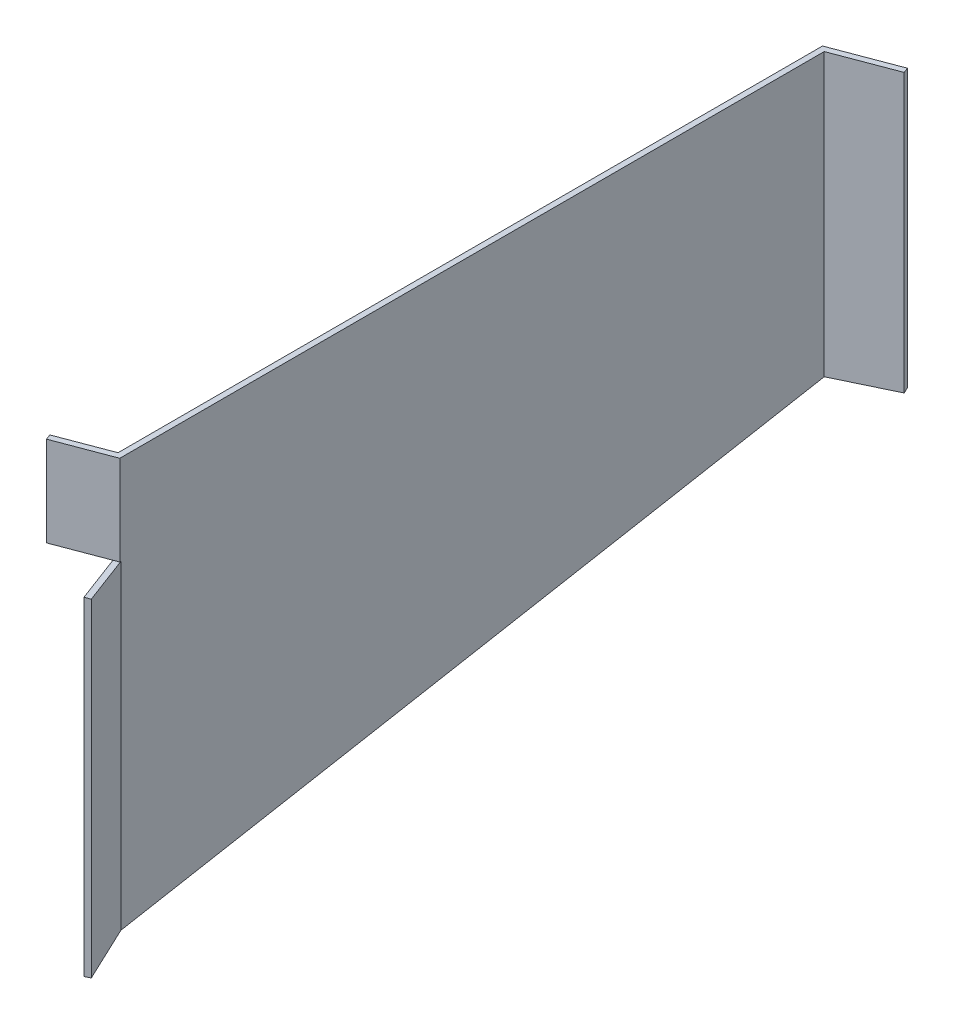
from build123d import *

# Parameters (mm, degrees)
SKETCH1_W           = 3.175
SKETCH1_H           = 395.409928
BOSS_EXTRUDE1_DEPTH = 228.6
CUT_EXTRUDE1_DEPTH  = 457.746156838
BOSS_EXTRUDE4_REACH = 458.746
BOSS_EXTRUDE5_DEPTH = 50.165
BOSS_EXTRUDE8_REACH = 449.107


with BuildPart() as part:
    # Sketch1 → Boss-Extrude1 (new body)
    with BuildSketch(Plane(origin=(0, 0, 0), x_dir=(1, 0, 0), z_dir=(0, 1, 0))):
        with Locations((1.5875, 197.704964)):
            Rectangle(SKETCH1_W, SKETCH1_H)
    extrude(amount=BOSS_EXTRUDE1_DEPTH)

    # Sketch2 → Cut-Extrude1 (cut, through all)
    with BuildSketch(Plane(origin=(3.175, 0, 0), x_dir=(0, 0, -1), z_dir=(1, 0, 0))):
        Polygon((0, 0), (395.409928, 71.795894), (395.409928, 0), align=None)
    extrude(amount=-CUT_EXTRUDE1_DEPTH, mode=Mode.SUBTRACT)

    # Boss-Extrude4: up to this plane
    boss_extrude4_end = Plane(origin=(0, 0, 0), z_dir=(0, 0.9839122845611679, 0.17865222161961358))
    # Sketch8 → Boss-Extrude4 (add, up to the surface)
    with BuildSketch(Plane(origin=(0, 228.6, 0), x_dir=(1, 0, 0), z_dir=(0, 1, 0)), mode=Mode.PRIVATE) as boss_extrude4_sk1:
        Polygon((0, 395.409928), (34.459069357, 408.410752554), (35.579830094, 405.440143126), (0, 392.016474486), align=None)
    boss_extrude4_tool1 = split(extrude(boss_extrude4_sk1.sketch, amount=-BOSS_EXTRUDE4_REACH, mode=Mode.PRIVATE), bisect_by=boss_extrude4_end, keep=Keep.BOTH, mode=Mode.PRIVATE)
    add(boss_extrude4_tool1.solids().sort_by_distance((17.511219, 228.6, -400.310838))[0])

    # Sketch9 → Boss-Extrude5 (add)
    with BuildSketch(Plane(origin=(0, 228.6, 0), x_dir=(1, 0, 0), z_dir=(0, 1, 0))):
        Polygon((3.175, 0), (-26.531094273, -11.207607374), (-27.65185501, -8.236997947), (3.175, 3.393453514), align=None)
    extrude(amount=-BOSS_EXTRUDE5_DEPTH)

    # Boss-Extrude8: up to this plane
    boss_extrude8_end = Plane(origin=(0, 0, 0), z_dir=(0, 0.9839122845611679, 0.17865222161961358))
    # Sketch13 → Boss-Extrude8 (add, up to the surface)
    with BuildSketch(Plane.XZ.offset(-178.435), mode=Mode.PRIVATE) as boss_extrude8_sk1:
        Polygon((0, 0), (10.19197679, 27.014135421), (13.162586217, 25.893374684), (1.954978843, -3.812719589), align=None)
    boss_extrude8_tool1 = split(extrude(boss_extrude8_sk1.sketch, amount=BOSS_EXTRUDE8_REACH, mode=Mode.PRIVATE), bisect_by=boss_extrude8_end, keep=Keep.BOTH, mode=Mode.PRIVATE)
    add(boss_extrude8_tool1.solids().sort_by_distance((6.346866, 178.435, 12.254186))[0])


solid = part.part
